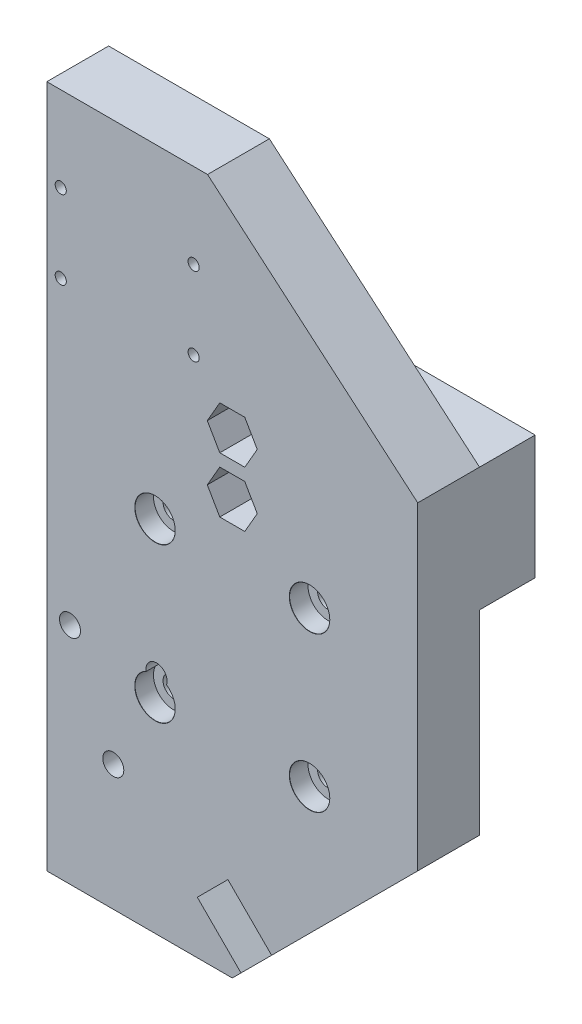
from build123d import *

# Parameters (mm, degrees)
SKETCH2_W                      = 60
SKETCH2_H                      = 72
BOSS_EXTRUDE1_DEPTH            = 10
SKETCH9_W                      = 60
SKETCH9_H                      = 20
BOSS_EXTRUDE2_DEPTH            = 9
CBORE_FOR_M3_SHCS1_AT_2_COUNT  = 2
CBORE_FOR_M3_SHCS1_AT_2_PITCH  = 25
CBORE_FOR_M3_SHCS1_AT_3_COUNT  = 2
CBORE_FOR_M3_SHCS1_AT_3_PITCH  = 35.355339059
CBORE_FOR_M3_SHCS1_AT_4_COUNT  = 2
CBORE_FOR_M3_SHCS1_AT_4_PITCH  = 25
CUT_EXTRUDE1_DEPTH             = 11
SKETCH8_R                      = 2.1
CUT_EXTRUDE2_DEPTH             = 49.135226186
SKETCH14_W                     = 60
SKETCH14_H                     = 9.57
BOSS_EXTRUDE3_DEPTH            = 10
CBORE_FOR_M3_SHCS2_D           = 3.4
CBORE_FOR_M3_SHCS2_CBORE_D     = 6.5
CBORE_FOR_M3_SHCS2_CBORE_DEPTH = 3
CUT_EXTRUDE3_DEPTH             = 58.772181022
BOSS_EXTRUDE4_DEPTH            = 10
SKETCH20_R                     = 0.9
CUT_EXTRUDE4_DEPTH             = 10
SKETCH21_W                     = 5
SKETCH21_H                     = 7
CUT_EXTRUDE5_DEPTH             = 10


with BuildPart() as part:
    # Sketch2 → Boss-Extrude1 (new body)
    with BuildSketch(Plane.XY):
        Rectangle(SKETCH2_W, SKETCH2_H)
    extrude(amount=BOSS_EXTRUDE1_DEPTH)

    # Sketch9 → Boss-Extrude2 (add)
    with BuildSketch(Plane(origin=(0, 0, 0), x_dir=(-1, 0, 0), z_dir=(0, 0, -1))):
        with Locations((0, 26)):
            Rectangle(SKETCH9_W, SKETCH9_H)
    extrude(amount=BOSS_EXTRUDE2_DEPTH)

    # Sketch6 → CBORE for M3 SHCS1 (revolve, cut)
    with BuildSketch(Plane(origin=(-12.5, 12.5, 10), x_dir=(0, -1, 0), z_dir=(1, 0, 0))):
        Polygon((0, 0), (0, 11.021463052), (1.7, 10), (1.7, 3), (3.25, 3), (3.25, 0.025), (3.275, 0), align=None)
    cbore_for_m3_shcs1 = revolve(axis=Axis((-12.5, 12.5, 16.35), (0, 0, -1)), mode=Mode.SUBTRACT)

    # CBORE for M3 SHCS1 at 2: CBORE for M3 SHCS1 ×2
    with Locations(*[(i * CBORE_FOR_M3_SHCS1_AT_2_PITCH, 0, 0) for i in range(1, CBORE_FOR_M3_SHCS1_AT_2_COUNT)]):
        add(cbore_for_m3_shcs1, mode=Mode.SUBTRACT)

    # CBORE for M3 SHCS1 at 3: CBORE for M3 SHCS1 ×2
    with Locations(*[Vector(0.7071067811865477, -0.7071067811865475, 0) * (i * CBORE_FOR_M3_SHCS1_AT_3_PITCH) for i in range(1, CBORE_FOR_M3_SHCS1_AT_3_COUNT)]):
        add(cbore_for_m3_shcs1, mode=Mode.SUBTRACT)

    # CBORE for M3 SHCS1 at 4: CBORE for M3 SHCS1 ×2
    with Locations(*[(0, -i * CBORE_FOR_M3_SHCS1_AT_4_PITCH, 0) for i in range(1, CBORE_FOR_M3_SHCS1_AT_4_COUNT)]):
        add(cbore_for_m3_shcs1, mode=Mode.SUBTRACT)

    # Sketch7 → Cut-Extrude1 (cut)
    with BuildSketch(Plane.XY.offset(10)):
        Polygon((4.041451884, 21.5), (2.020725942, 25), (-2.020725942, 25), (-4.041451884, 21.5), (-2.020725942, 18), (2.020725942, 18), align=None)
        Polygon((4.041451884, 30.5), (2.020725942, 34), (-2.020725942, 34), (-4.041451884, 30.5), (-2.020725942, 27), (2.020725942, 27), align=None)
    extrude(amount=-CUT_EXTRUDE1_DEPTH, mode=Mode.SUBTRACT)

    # Sketch8 → Cut-Extrude2 (cut, through all)
    with BuildSketch(Plane.XY.offset(-1)):
        with Locations((0, 30.5)):
            Circle(SKETCH8_R)
        with Locations((0, 21.5)):
            Circle(SKETCH8_R)
    extrude(amount=-CUT_EXTRUDE2_DEPTH, mode=Mode.SUBTRACT)

    # Sketch14 → Boss-Extrude3 (add)
    with BuildSketch(Plane.XY.offset(10)):
        with Locations((0, -40.785)):
            Rectangle(SKETCH14_W, SKETCH14_H)
    extrude(amount=-BOSS_EXTRUDE3_DEPTH)

    # CBORE for M3 SHCS2 (through all)
    with Locations(Plane(origin=(0, 0, 0), x_dir=(-1, 0, 0), z_dir=(0, 0, -1))):
        with Locations((19.25, -25.25), (12.25, -9.25), (26.25, -9.25)):
            CounterBoreHole(CBORE_FOR_M3_SHCS2_D / 2, CBORE_FOR_M3_SHCS2_CBORE_D / 2, CBORE_FOR_M3_SHCS2_CBORE_DEPTH)

    # Sketch18 → Cut-Extrude3 (cut, through all)
    with BuildSketch(Plane.XY.offset(10)):
        Polygon((0, -45.57), (30, -15.57), (30, -45.57), align=None)
    extrude(amount=-CUT_EXTRUDE3_DEPTH, mode=Mode.SUBTRACT)

    # Sketch19 → Boss-Extrude4 (add)
    with BuildSketch(Plane.XY.offset(10)):
        Polygon((-30, 36), (-30, 65), (-4, 65), (30, 36), align=None)
    extrude(amount=-BOSS_EXTRUDE4_DEPTH)

    # Sketch20 → Cut-Extrude4 (cut)
    with BuildSketch(Plane.XY.offset(10)):
        with Locations((-27.75, 51.284)):
            Circle(SKETCH20_R)
        with Locations((-27.75, 38.584)):
            Circle(SKETCH20_R)
        with Locations((-6.25, 38.584)):
            Circle(SKETCH20_R)
        with Locations((-6.25, 51.284)):
            Circle(SKETCH20_R)
    extrude(amount=-CUT_EXTRUDE4_DEPTH, mode=Mode.SUBTRACT)

    # Sketch21 → Cut-Extrude5 (cut)
    with BuildSketch(Plane(origin=(22.785, -22.785, 0), x_dir=(0, 0, -1), z_dir=(0.707106781186544, -0.7071067811865511, 0))):
        with Locations((-7.5, -26.722856019)):
            Rectangle(SKETCH21_W, SKETCH21_H)
    extrude(amount=-CUT_EXTRUDE5_DEPTH, mode=Mode.SUBTRACT)


solid = part.part
